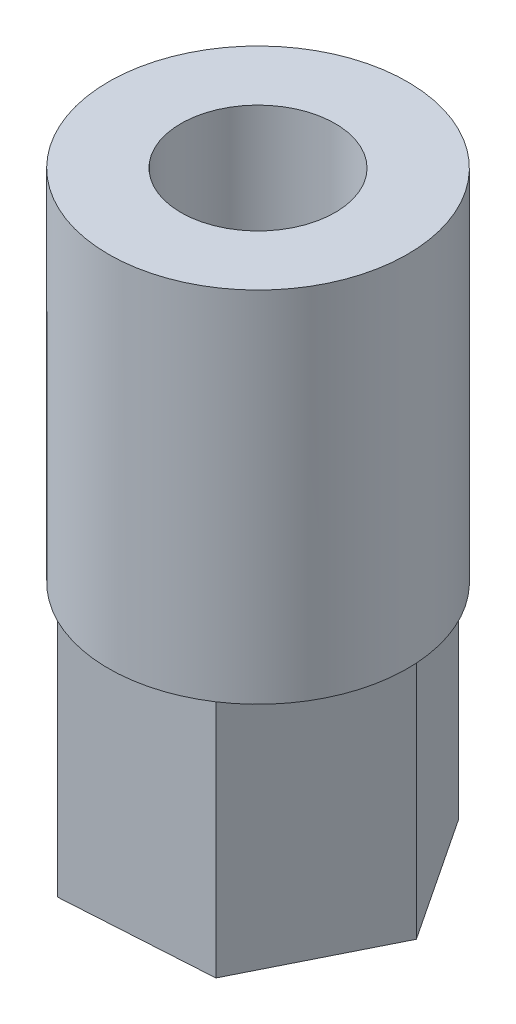
from build123d import *

# Parameters (mm, degrees)
SKETCH1_R           = 3.175
BOSS_EXTRUDE1_DEPTH = 7.62
BOSS_EXTRUDE2_DEPTH = 5.08
SKETCH4_R           = 1.6383
CUT_EXTRUDE1_DEPTH  = 8.89


with BuildPart() as part:
    # Sketch1 → Boss-Extrude1 (new body)
    with BuildSketch(Plane(origin=(0, 0, 0), x_dir=(1, 0, 0), z_dir=(0, 1, 0))):
        with Locations(Location((0, 0, 0), (0, 0, 90))):
            Circle(SKETCH1_R)
    extrude(amount=BOSS_EXTRUDE1_DEPTH)

    # Sketch3 → Boss-Extrude2 (add)
    with BuildSketch(Plane.XZ):
        Polygon((-1.416669754, 2.841420738), (-3.169077419, 0.193838373), (-1.752407664, -2.647582365), (1.416669754, -2.841420738), (3.169077419, -0.193838373), (1.752407664, 2.647582365), align=None)
    extrude(amount=BOSS_EXTRUDE2_DEPTH)

    # Sketch4 → Cut-Extrude1 (cut)
    with BuildSketch(Plane(origin=(0, 7.62, 0), x_dir=(1, 0, 0), z_dir=(0, 1, 0))):
        with Locations(Location((0, 0, 0), (0, 0, 270))):
            Circle(SKETCH4_R)
    extrude(amount=-CUT_EXTRUDE1_DEPTH, mode=Mode.SUBTRACT)


solid = part.part
